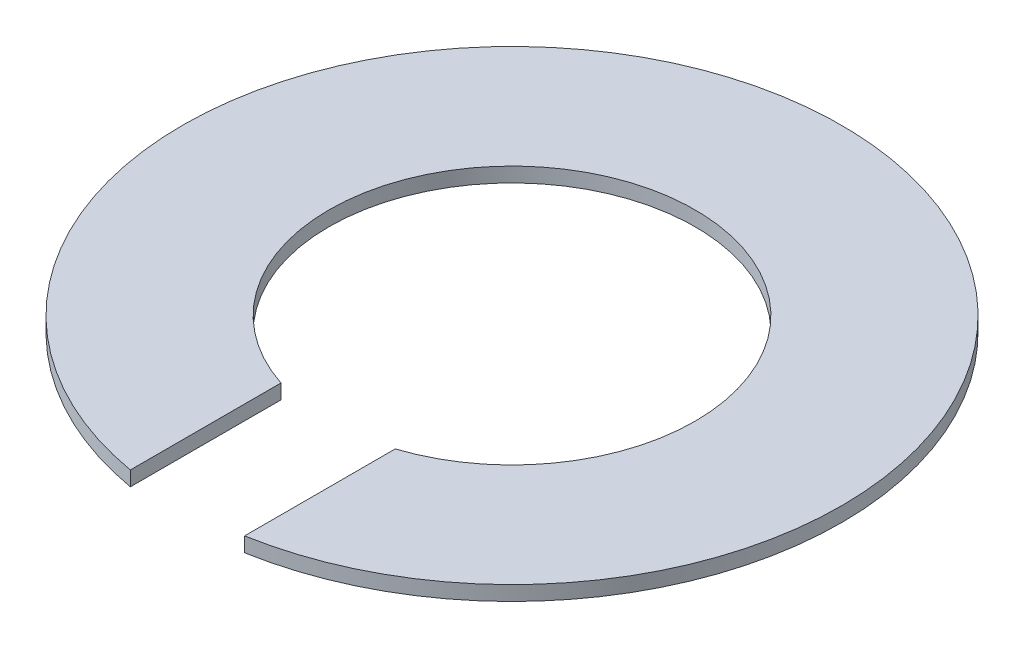
from build123d import *

# Parameters (mm, degrees)
BOSS_EXTRUDE1_DEPTH = 0.254


with BuildPart() as part:
    # Sketch1 → Boss-Extrude1 (new body)
    with BuildSketch(Plane(origin=(0, 0, 0), x_dir=(1, 0, 0), z_dir=(0, 1, 0))):
        with BuildLine():
            Line((-0.990450861, -5.628519529), (-0.990450861, -3.016559645))
            ThreePointArc((-0.990450861, -3.016559645), (0, 3.175), (0.990450861, -3.016559645))
            Line((0.990450861, -3.016559645), (0.990450861, -5.628519529))
            ThreePointArc((0.990450861, -5.628519529), (0, 5.715), (-0.990450861, -5.628519529))
        make_face()
    extrude(amount=BOSS_EXTRUDE1_DEPTH)


solid = part.part
